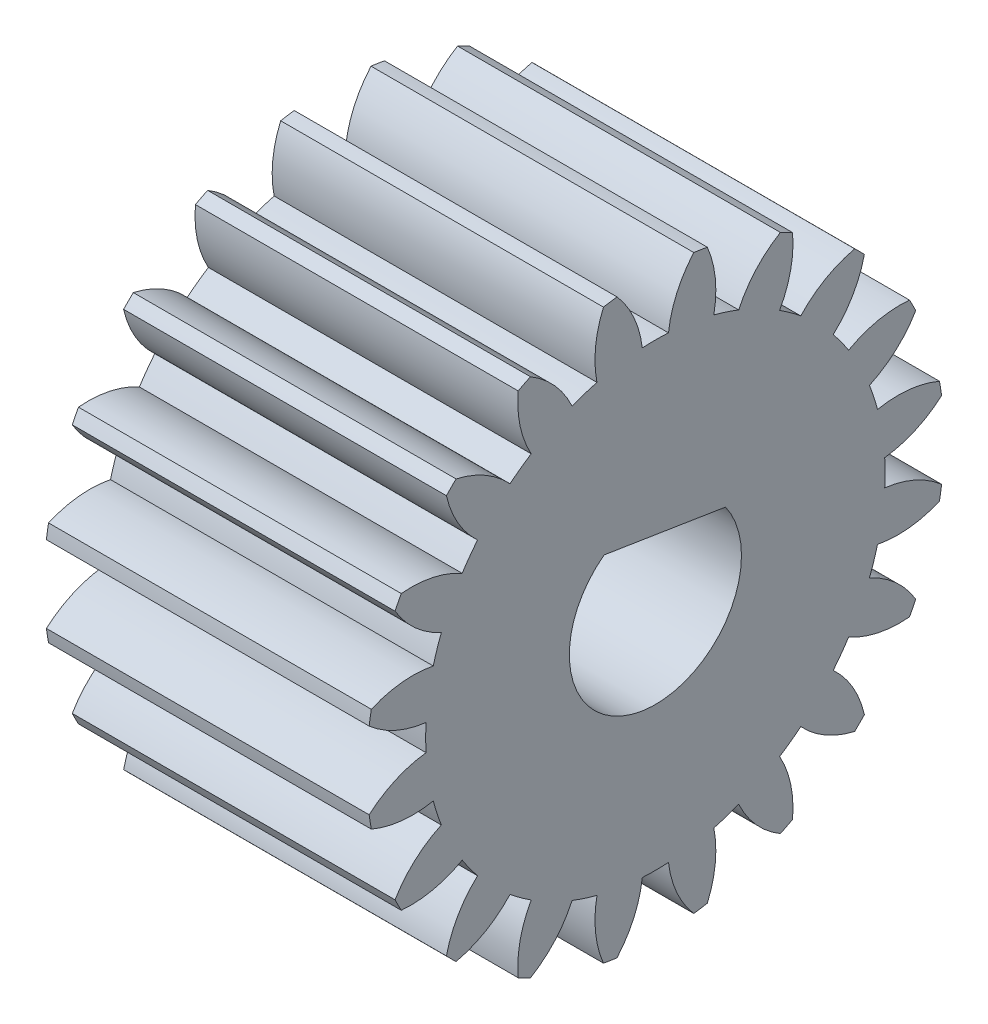
from build123d import *

# Parameters (mm, degrees)
BASPROSKE_W         = 15
BASPROSKE_H         = 13.42
TOOTHCUT_DEPTH      = 25.190758566
TEETHCUTS_COUNT     = 20
TEETHCUTS_ANGLE     = 342
BORSKE_R            = 4
BORE_DEPTH          = 50.0000508
BOSS_EXTRUDE1_START = -15
BOSS_EXTRUDE1_DEPTH = 15
SKETCH2_W           = 1.2
SKETCH2_H           = 8
CUT_EXTRUDE1_DEPTH  = 2


with BuildPart() as part:
    # BasProSke → Base-Revolve (revolve)
    with BuildSketch(Plane(origin=(0, 0, 0), x_dir=(1, 0, 0), z_dir=(0, 1, 0)), mode=Mode.PRIVATE) as base_revolve_sk:
        with Locations((7.5, 6.71)):
            Rectangle(BASPROSKE_W, BASPROSKE_H)
    revolve(base_revolve_sk.sketch.rotate(Axis((-10, 0, 0), (1, 0, 0)), 180), axis=Axis((-10, 0, 0), (1, 0, 0)))

    # TooCutSke → ToothCut (cut, through all)
    with BuildSketch(Plane(origin=(0, 0, 0), x_dir=(0, 0, -1), z_dir=(1, 0, 0))):
        with BuildLine():
            ThreePointArc((0.607848894, 10.656678456), (0, 10.674), (-0.607848894, 10.656678456))
            ThreePointArc((-0.607848894, 10.656678456), (-1.001950595, 12.081933102), (-1.804853959, 13.32371132))
            ThreePointArc((-1.804853959, 13.32371132), (0, 13.4454), (1.804853959, 13.32371132))
            ThreePointArc((1.804853959, 13.32371132), (1.001950595, 12.081933102), (0.607848894, 10.656678456))
        make_face()
    toothcut = extrude(amount=TOOTHCUT_DEPTH, mode=Mode.SUBTRACT)

    # TeethCuts: ToothCut ×20 about axis
    teethcuts_axis = Axis((-10, 0, 0), (1, 0, 0))
    for i in range(1, TEETHCUTS_COUNT):
        add(toothcut.rotate(teethcuts_axis, i * TEETHCUTS_ANGLE / (TEETHCUTS_COUNT - 1)), mode=Mode.SUBTRACT)

    # BorSke → Bore (cut, symmetric)
    with BuildSketch(Plane(origin=(0, 0, 0), x_dir=(0, 0, -1), z_dir=(1, 0, 0))):
        with Locations(Location((0, 0, 0), (0, 0, 180))):
            Circle(BORSKE_R)
    extrude(amount=BORE_DEPTH, both=True, mode=Mode.SUBTRACT)

    # Sketch1 → Boss-Extrude1 (add)
    with BuildSketch(Plane.ZY.offset(BOSS_EXTRUDE1_START)):
        with BuildLine():
            Line((-3.25941874, 2.318661139), (2.383385736, 3.212393568))
            ThreePointArc((2.383385736, 3.212393568), (-0.62573786, 3.950753362), (-3.25941874, 2.318661139))
        make_face()
    extrude(amount=BOSS_EXTRUDE1_DEPTH)

    # Sketch2 → Cut-Extrude1 (cut)
    with BuildSketch(Plane.ZY):
        with Locations((-7, 0)):
            Rectangle(SKETCH2_W, SKETCH2_H)
    extrude(amount=-CUT_EXTRUDE1_DEPTH, mode=Mode.SUBTRACT)


solid = part.part
